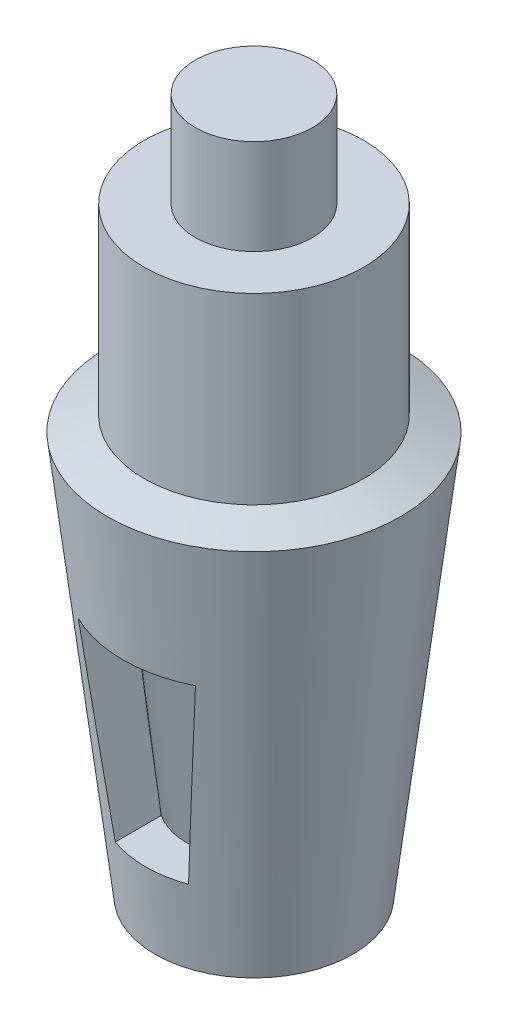
from build123d import *

# Parameters (mm, degrees)
CUT_EXTRUDE1_DEPTH      = 199.242276016
CUT_EXTRUDE1_DEPTH_BACK = 199.242276016


with BuildPart() as part:
    # Sketch1 → Revolve1 (revolve)
    with BuildSketch(Plane.XY, mode=Mode.PRIVATE) as revolve1_sk:
        with BuildLine():
            Line((16, 0), (27, 0))
            Line((27, 0), (40, 110))
            Line((40, 110), (30, 114))
            Line((30, 114), (30, 164))
            Line((30, 164), (16, 164))
            Line((16, 164), (16, 190))
            Line((16, 190), (0, 190))
            Line((0, 190), (0, 147.51886968))
            Line((0, 147.51886968), (20, 147.51886968))
            Line((20, 147.51886968), (20, 91.51886968))
            ThreePointArc((20, 91.51886968), (23.714454765, 89.865931944), (24.97300455, 86))
            Line((24.97300455, 86), (16, 0))
        make_face()
    revolve(revolve1_sk.sketch.rotate(Axis((0, 273.925007331, 0), (0, -1, 0)), 90), axis=Axis((0, 273.925007331, 0), (0, -1, 0)))

    # Sketch2 → Cut-Extrude1 (cut, two sides: drawn at the far end of the back side and taken through both)
    with BuildSketch(Plane.XY.offset(-CUT_EXTRUDE1_DEPTH_BACK)):
        Polygon((-10, 22), (10, 22), (16, 74), (-16, 74), align=None)
    extrude(amount=CUT_EXTRUDE1_DEPTH + CUT_EXTRUDE1_DEPTH_BACK, mode=Mode.SUBTRACT)


solid = part.part
